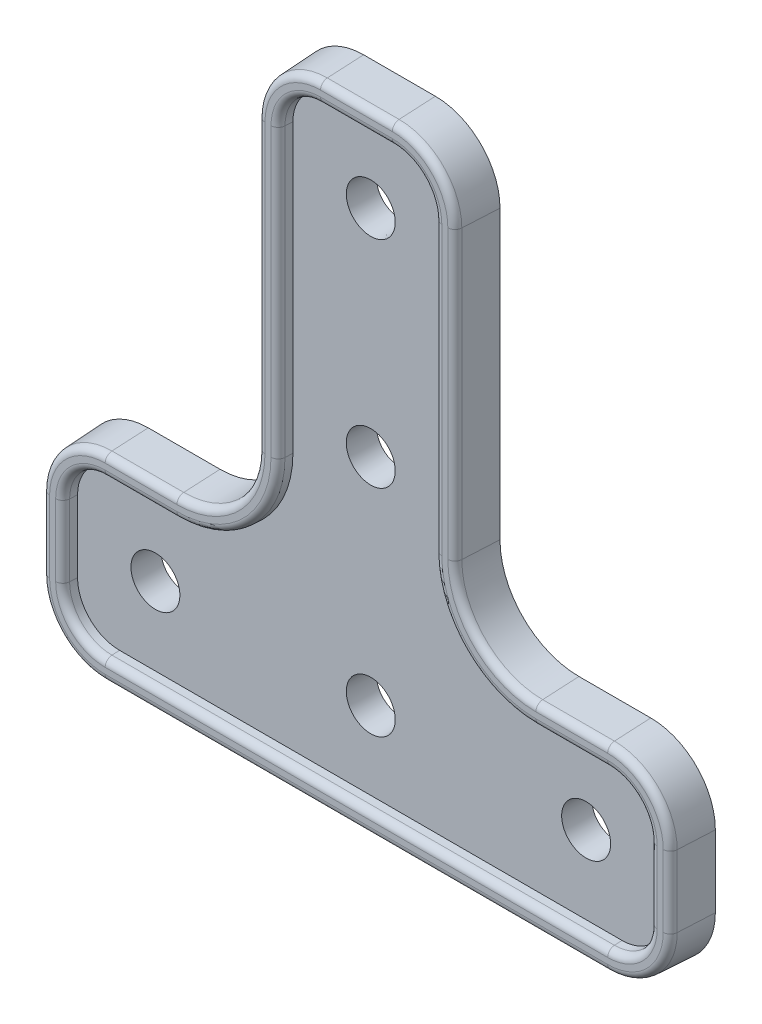
from build123d import *

# Parameters (mm, degrees)
BOSS_EXTRUDE1_DEPTH = 2
FILLET1_R           = 5
SKETCH2_R           = 1.6
CUT_EXTRUDE1_DEPTH  = 38.553295461
MOVE_FACE1_BY       = 0.5
MOVE_FACE1_2_BY     = 0.5
MOVE_FACE1_3_BY     = 0.5
MOVE_FACE1_4_BY     = 0.5
MOVE_FACE1_5_BY     = 0.5
MOVE_FACE1_6_BY     = 0.5
MOVE_FACE1_7_BY     = 0.5
MOVE_FACE1_8_BY     = 0.5
MOVE_FACE1_9_BY     = 0.5
MOVE_FACE1_10_BY    = 0.5
MOVE_FACE1_11_BY    = 0.5
MOVE_FACE1_12_BY    = 0.5
MOVE_FACE1_13_BY    = 0.5
MOVE_FACE1_14_BY    = 0.5
MOVE_FACE1_15_BY    = 0.5
MOVE_FACE1_16_BY    = 0.5
DRAFT1_ANGLE        = -3
BOSS_EXTRUDE3_DEPTH = 1
BOSS_EXTRUDE3_DRAFT = 3
FILLET3_R           = 0.5
CUT_EXTRUDE2_DEPTH  = 0.2
CUT_EXTRUDE2_DRAFT  = -3


with BuildPart() as part:
    # Sketch1 → Boss-Extrude1 (new body)
    with BuildSketch(Plane.XY):
        Polygon((-7.5, 30), (7.5, 30), (7.5, 0), (22.5, 0), (22.5, -15), (-22.5, -15), (-22.5, 0), (-7.5, 0), align=None)
    extrude(amount=BOSS_EXTRUDE1_DEPTH)

    # Fillet1
    fillet1_edges = [part.edges().sort_by_distance(p)[0] for p in [
        (-7.5, 30, 1),
        (7.5, 30, 1),
        (7.5, 0, 1),
        (22.5, 0, 1),
        (22.5, -15, 1),
        (-22.5, -15, 1),
        (-22.5, 0, 1),
        (-7.5, 0, 1),
    ]]
    fillet(fillet1_edges, radius=FILLET1_R)

    # Sketch2 → Cut-Extrude1 (cut, through all)
    with BuildSketch(Plane.XY.offset(2)):
        with Locations((-15, -7.5)):
            Circle(SKETCH2_R)
        with Locations((0, -7.5)):
            Circle(SKETCH2_R)
        with Locations((15, -7.5)):
            Circle(SKETCH2_R)
        with Locations((0, 22.5)):
            Circle(SKETCH2_R)
        with Locations((0, 7.5)):
            Circle(SKETCH2_R)
    extrude(amount=-CUT_EXTRUDE1_DEPTH, mode=Mode.SUBTRACT)

    # Move Face1: a curved face moved inward by 0.5
    add(Solid.thicken(part.faces().sort_by_distance((-8.964466094, 1.464466094, 1))[0], -MOVE_FACE1_BY), mode=Mode.SUBTRACT)

    # Move Face1 2: a face moved inward by 0.5
    extrude(part.faces().sort_by_distance((-15, 0, 1))[0], amount=MOVE_FACE1_2_BY, dir=(0, -1, 0), mode=Mode.SUBTRACT)

    # Move Face1 3: a curved face moved inward by 0.5
    add(Solid.thicken(part.faces().sort_by_distance((-21.035533906, -1.464466094, 1))[0], -MOVE_FACE1_3_BY), mode=Mode.SUBTRACT)

    # Move Face1 4: a face moved inward by 0.5
    extrude(part.faces().sort_by_distance((-22.5, -7.5, 1))[0], amount=MOVE_FACE1_4_BY, dir=(1, 0, 0), mode=Mode.SUBTRACT)

    # Move Face1 5: a curved face moved inward by 0.5
    add(Solid.thicken(part.faces().sort_by_distance((-21.035533906, -13.535533906, 1))[0], -MOVE_FACE1_5_BY), mode=Mode.SUBTRACT)

    # Move Face1 6: a face moved inward by 0.5
    extrude(part.faces().sort_by_distance((0, -15, 1))[0], amount=MOVE_FACE1_6_BY, dir=(0, 1, 0), mode=Mode.SUBTRACT)

    # Move Face1 7: a curved face moved inward by 0.5
    add(Solid.thicken(part.faces().sort_by_distance((21.035533906, -13.535533906, 1))[0], -MOVE_FACE1_7_BY), mode=Mode.SUBTRACT)

    # Move Face1 8: a face moved inward by 0.5
    extrude(part.faces().sort_by_distance((22.5, -7.5, 1))[0], amount=MOVE_FACE1_8_BY, dir=(-1, 0, 0), mode=Mode.SUBTRACT)

    # Move Face1 9: a curved face moved inward by 0.5
    add(Solid.thicken(part.faces().sort_by_distance((21.035533906, -1.464466094, 1))[0], -MOVE_FACE1_9_BY), mode=Mode.SUBTRACT)

    # Move Face1 10: a face moved inward by 0.5
    extrude(part.faces().sort_by_distance((15, 0, 1))[0], amount=MOVE_FACE1_10_BY, dir=(0, -1, 0), mode=Mode.SUBTRACT)

    # Move Face1 11: a curved face moved inward by 0.5
    add(Solid.thicken(part.faces().sort_by_distance((8.964466094, 1.464466094, 1))[0], -MOVE_FACE1_11_BY), mode=Mode.SUBTRACT)

    # Move Face1 12: a face moved inward by 0.5
    extrude(part.faces().sort_by_distance((7.5, 15, 1))[0], amount=MOVE_FACE1_12_BY, dir=(-1, 0, 0), mode=Mode.SUBTRACT)

    # Move Face1 13: a curved face moved inward by 0.5
    add(Solid.thicken(part.faces().sort_by_distance((6.035533906, 28.535533906, 1))[0], -MOVE_FACE1_13_BY), mode=Mode.SUBTRACT)

    # Move Face1 14: a face moved inward by 0.5
    extrude(part.faces().sort_by_distance((0, 30, 1))[0], amount=MOVE_FACE1_14_BY, dir=(0, -1, 0), mode=Mode.SUBTRACT)

    # Move Face1 15: a curved face moved inward by 0.5
    add(Solid.thicken(part.faces().sort_by_distance((-6.035533906, 28.535533906, 1))[0], -MOVE_FACE1_15_BY), mode=Mode.SUBTRACT)

    # Move Face1 16: a face moved inward by 0.5
    extrude(part.faces().sort_by_distance((-7.5, 15, 1))[0], amount=MOVE_FACE1_16_BY, dir=(1, 0, 0), mode=Mode.SUBTRACT)

    # Draft1
    draft1_faces = [part.faces().sort_by_distance(p)[0] for p in [
        (13.4, -7.5, 1),
        (-1.6, 22.5, 1),
        (-1.6, 7.5, 1),
        (-1.6, -7.5, 1),
        (-16.6, -7.5, 1),
        (-20.681980515, -1.818019485, 1),
        (-22, -7.5, 1),
        (-20.681980515, -13.181980515, 1),
        (0, -14.5, 1),
        (20.681980515, -13.181980515, 1),
        (22, -7.5, 1),
        (20.681980515, -1.818019485, 1),
        (15, -0.5, 1),
        (8.610912703, 1.110912703, 1),
        (7, 15, 1),
        (5.681980515, 28.181980515, 1),
        (0, 29.5, 1),
        (-5.681980515, 28.181980515, 1),
        (-7, 15, 1),
        (-8.610912703, 1.110912703, 1),
        (-15, -0.5, 1),
    ]]
    draft(draft1_faces, Plane(origin=(0, 0, 0), x_dir=(-1, 0, 0), z_dir=(0, 0, -1)), DRAFT1_ANGLE)


with BuildPart() as boss_extrude3_tool:
    # Sketch4 → Boss-Extrude3 (with draft: the straight prism first)
    with BuildSketch(Plane.XY.offset(2)):
        with BuildLine():
            Line((-17.5, -14.395184441), (17.5, -14.395184441))
            ThreePointArc((17.5, -14.395184441), (20.607864723, -13.107864723), (21.895184441, -10))
            Line((21.895184441, -10), (21.895184441, -5))
            ThreePointArc((21.895184441, -5), (20.607864723, -1.892135277), (17.5, -0.604815559))
            Line((17.5, -0.604815559), (12.5, -0.604815559))
            ThreePointArc((12.5, -0.604815559), (8.536796911, 1.036796911), (6.895184441, 5))
            Line((6.895184441, 5), (6.895184441, 25))
            ThreePointArc((6.895184441, 25), (5.607864723, 28.107864723), (2.5, 29.395184441))
            Line((2.5, 29.395184441), (-2.5, 29.395184441))
            ThreePointArc((-2.5, 29.395184441), (-5.607864723, 28.107864723), (-6.895184441, 25))
            Line((-6.895184441, 25), (-6.895184441, 5))
            ThreePointArc((-6.895184441, 5), (-8.536796911, 1.036796911), (-12.5, -0.604815559))
            Line((-12.5, -0.604815559), (-17.5, -0.604815559))
            ThreePointArc((-17.5, -0.604815559), (-20.607864723, -1.892135277), (-21.895184441, -5))
            Line((-21.895184441, -5), (-21.895184441, -10))
            ThreePointArc((-21.895184441, -10), (-20.607864723, -13.107864723), (-17.5, -14.395184441))
        make_face()
        with BuildLine():
            Line((-17.5, -12.921388331), (17.5, -12.921388331))
            ThreePointArc((17.5, -12.921388331), (19.565733499, -12.065733499), (20.421388331, -10))
            Line((20.421388331, -10), (20.421388331, -5))
            ThreePointArc((20.421388331, -5), (19.565733499, -2.934266501), (17.5, -2.078611669))
            Line((17.5, -2.078611669), (12.5, -2.078611669))
            ThreePointArc((12.5, -2.078611669), (7.494665688, -0.005334312), (5.421388331, 5))
            Line((5.421388331, 5), (5.421388331, 25))
            ThreePointArc((5.421388331, 25), (4.565733499, 27.065733499), (2.5, 27.921388331))
            Line((2.5, 27.921388331), (-2.5, 27.921388331))
            ThreePointArc((-2.5, 27.921388331), (-4.565733499, 27.065733499), (-5.421388331, 25))
            Line((-5.421388331, 25), (-5.421388331, 5))
            ThreePointArc((-5.421388331, 5), (-7.494665688, -0.005334312), (-12.5, -2.078611669))
            Line((-12.5, -2.078611669), (-17.5, -2.078611669))
            ThreePointArc((-17.5, -2.078611669), (-19.565733499, -2.934266501), (-20.421388331, -5))
            Line((-20.421388331, -5), (-20.421388331, -10))
            ThreePointArc((-20.421388331, -10), (-19.565733499, -12.065733499), (-17.5, -12.921388331))
        make_face(mode=Mode.SUBTRACT)
    extrude(amount=BOSS_EXTRUDE3_DEPTH)
    # Boss-Extrude3: the draft: its side faces are tilted about the plane it starts from
    boss_extrude3_sides = [boss_extrude3_tool.faces().sort_by_distance(p)[0] for p in [
        (-20.607864723, -1.892135277, 2.5),
        (-21.895184441, -7.5, 2.5),
        (-20.607864723, -13.107864723, 2.5),
        (0, -14.395184441, 2.5),
        (20.607864723, -13.107864723, 2.5),
        (21.895184441, -7.5, 2.5),
        (20.607864723, -1.892135277, 2.5),
        (15, -0.604815559, 2.5),
        (8.536796911, 1.036796911, 2.5),
        (6.895184441, 15, 2.5),
        (5.607864723, 28.107864723, 2.5),
        (0, 29.395184441, 2.5),
        (-5.607864723, 28.107864723, 2.5),
        (-6.895184441, 15, 2.5),
        (-8.536796911, 1.036796911, 2.5),
        (-15, -0.604815559, 2.5),
        (-15, -2.078611669, 2.5),
        (-7.494665688, -0.005334312, 2.5),
        (-5.421388331, 15, 2.5),
        (-4.565733499, 27.065733499, 2.5),
        (0, 27.921388331, 2.5),
        (4.565733499, 27.065733499, 2.5),
        (5.421388331, 15, 2.5),
        (7.494665688, -0.005334312, 2.5),
        (15, -2.078611669, 2.5),
        (19.565733499, -2.934266501, 2.5),
        (20.421388331, -7.5, 2.5),
        (19.565733499, -12.065733499, 2.5),
        (0, -12.921388331, 2.5),
        (-19.565733499, -12.065733499, 2.5),
        (-20.421388331, -7.5, 2.5),
        (-19.565733499, -2.934266501, 2.5),
    ]]
    draft(boss_extrude3_sides, Plane.XY.offset(2), BOSS_EXTRUDE3_DRAFT)


with BuildPart() as part_1:
    add(part.part)

    # Boss-Extrude3: add boss_extrude3_tool
    add(boss_extrude3_tool.part)

    # Fillet3
    fillet3_edges = [part_1.edges().sort_by_distance(p)[0] for p in [
        (-20.570806827, -13.070806827, 3),
        (0, -14.342776662, 3),
        (20.570806827, -13.070806827, 3),
        (21.842776662, -7.5, 3),
        (20.570806827, -1.929193173, 3),
        (15, -0.657223338, 3),
        (8.499739015, 0.999739015, 3),
        (6.842776662, 15, 3),
        (5.570806827, 28.070806827, 3),
        (0, 29.342776662, 3),
        (-5.570806827, 28.070806827, 3),
        (-6.842776662, 15, 3),
        (-8.499739015, 0.999739015, 3),
        (-15, -0.657223338, 3),
        (-20.570806827, -1.929193173, 3),
        (-21.842776662, -7.5, 3),
        (-19.602791396, -12.102791396, 3),
        (0, -12.97379611, 3),
        (19.602791396, -12.102791396, 3),
        (20.47379611, -7.5, 3),
        (19.602791396, -2.897208604, 3),
        (15, -2.02620389, 3),
        (7.531723584, 0.031723584, 3),
        (5.47379611, 15, 3),
        (4.602791396, 27.102791396, 3),
        (0, 27.97379611, 3),
        (-4.602791396, 27.102791396, 3),
        (-5.47379611, 15, 3),
        (-7.531723584, 0.031723584, 3),
        (-15, -2.02620389, 3),
        (-19.602791396, -2.897208604, 3),
        (-20.47379611, -7.5, 3),
    ]]
    fillet(fillet3_edges, radius=FILLET3_R)


with BuildPart() as cut_extrude2_tool:
    # Sketch5 → Cut-Extrude2 (with draft: the straight prism first)
    with BuildSketch(Plane(origin=(0, 0, 0), x_dir=(-1, 0, 0), z_dir=(0, 0, -1))):
        with BuildLine():
            Line((-14.5, -13.8), (14.5, -13.8))
            ThreePointArc((14.5, -13.8), (14.853553391, -13.653553391), (15, -13.3))
            Line((15, -13.3), (15, -10.3))
            ThreePointArc((15, -10.3), (14.853553391, -9.946446609), (14.5, -9.8))
            Line((14.5, -9.8), (-14.5, -9.8))
            ThreePointArc((-14.5, -9.8), (-14.853553391, -9.946446609), (-15, -10.3))
            Line((-15, -10.3), (-15, -13.3))
            ThreePointArc((-15, -13.3), (-14.853553391, -13.653553391), (-14.5, -13.8))
        make_face()
    extrude(amount=-CUT_EXTRUDE2_DEPTH)
    # Cut-Extrude2: the draft: its side faces are tilted about the plane it starts from
    cut_extrude2_sides = [cut_extrude2_tool.faces().sort_by_distance(p)[0] for p in [
        (0, -13.8, 0.1),
        (-14.853553391, -13.653553391, 0.1),
        (-15, -11.8, 0.1),
        (-14.853553391, -9.946446609, 0.1),
        (0, -9.8, 0.1),
        (14.853553391, -9.946446609, 0.1),
        (15, -11.8, 0.1),
        (14.853553391, -13.653553391, 0.1),
    ]]
    draft(cut_extrude2_sides, Plane(origin=(0, 0, 0), x_dir=(-1, 0, 0), z_dir=(0, 0, -1)), CUT_EXTRUDE2_DRAFT)


with BuildPart() as part_2:
    add(part_1.part)

    # Cut-Extrude2: cut by cut_extrude2_tool
    add(cut_extrude2_tool.part, mode=Mode.SUBTRACT)


solid = part_2.part
